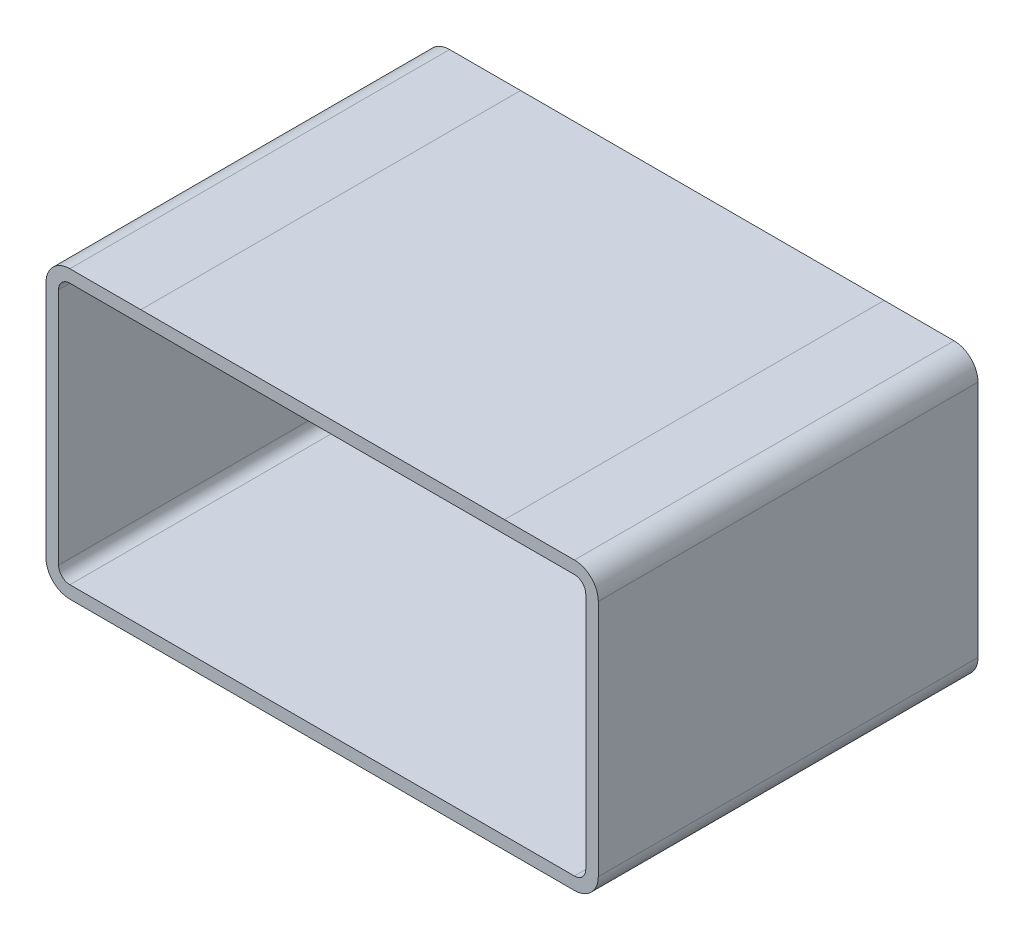
from build123d import *

# Parameters (mm, degrees)
SKETCH1_R           = 2.449
BOSS_EXTRUDE1_DEPTH = 2
BOSS_EXTRUDE2_START = 61.5600102
BOSS_EXTRUDE2_DEPTH = 61.5600102


with BuildPart() as part:
    # Sketch1 → Boss-Extrude1 (new body)
    with BuildSketch(Plane(origin=(0, 7e-09, 33.21323041), x_dir=(-1, 0, 0), z_dir=(0, -2.14626958308228e-10, -1.0))):
        with BuildLine():
            Line((-81.739723186, 76.765508674), (-70.033136805, 76.765508674))
            Line((-70.033136805, 76.765508674), (-9.168561928, 76.76533218))
            Line((-9.168561928, 76.76533218), (2.715276814, 76.76533218))
            ThreePointArc((2.715276814, 76.76533218), (5.543703939, 75.593759305), (6.715276814, 72.76533218))
            Line((6.715276814, 72.76533218), (6.715276814, 40.456513609))
            Line((6.715276814, 40.456513609), (6.715276814, 38.856513609))
            Line((6.715276814, 38.856513609), (6.715276814, 32.856513609))
            ThreePointArc((6.715276814, 32.856513609), (5.543703939, 30.028086484), (2.715276814, 28.856513609))
            Line((2.715276814, 28.856513609), (-81.739723186, 28.856513609))
            ThreePointArc((-81.739723186, 28.856513609), (-84.56815031, 30.028086484), (-85.739723186, 32.856513609))
            Line((-85.739723186, 32.856513609), (-85.739723186, 38.856513609))
            Line((-85.739723186, 38.856513609), (-85.739723186, 40.456513609))
            Line((-85.739723186, 40.456513609), (-85.739723186, 72.765508674))
            ThreePointArc((-85.739723186, 72.765508674), (-84.56815031, 75.593935798), (-81.739723186, 76.765508674))
        make_face()
        with Locations(Location((-2.764563873, 57.52531361, 0), (0, 0, 90))):
            Circle(SKETCH1_R, mode=Mode.SUBTRACT)
        with Locations(Location((-76.437246444, 57.525527244, 0), (0, 0, 90))):
            Circle(SKETCH1_R, mode=Mode.SUBTRACT)
        with BuildLine():
            Line((-63.603943309, 45.46049003), (-60.552841344, 45.460481183))
            Line((-60.552841344, 45.460481183), (-18.649041914, 45.460359671))
            Line((-18.649041914, 45.460359671), (-15.597940144, 45.460350824))
            ThreePointArc((-15.597940144, 45.460350824), (-12.365044057, 46.799449246), (-11.025926886, 50.032337566))
            Line((-11.025926886, 50.032337566), (-11.02588343, 65.018337566))
            ThreePointArc((-11.02588343, 65.018337566), (-12.364981852, 68.251233653), (-15.597870172, 69.590350824))
            Line((-15.597870172, 69.590350824), (-18.648972138, 69.59035918))
            Line((-18.648972138, 69.59035918), (-37.600871755, 69.590414358))
            Line((-37.600871755, 69.590414358), (-37.600871755, 70.340426004))
            Line((-37.600871755, 70.340426004), (-41.600871755, 70.340426004))
            Line((-41.600871755, 70.340426004), (-41.600871755, 69.590426004))
            Line((-41.600871755, 69.590426004), (-60.552771373, 69.590481183))
            Line((-60.552771373, 69.590481183), (-63.603873338, 69.59049003))
            ThreePointArc((-63.603873338, 69.59049003), (-66.836769424, 68.251391608), (-68.175886596, 65.018503288))
            Line((-68.175886596, 65.018503288), (-68.175930051, 50.032503288))
            ThreePointArc((-68.175930051, 50.032503288), (-66.83683163, 46.799607201), (-63.603943309, 45.46049003))
        make_face(mode=Mode.SUBTRACT)
    extrude(amount=BOSS_EXTRUDE1_DEPTH)

    # Sketch2 → Boss-Extrude2 (add)
    with BuildSketch(Plane.XY.offset(33.21323041).offset(BOSS_EXTRUDE2_START)):
        with BuildLine():
            Line((81.739723186, 28.856513609), (-2.715276814, 28.856513609))
            ThreePointArc((-2.715276814, 28.856513609), (-5.543703939, 30.028086484), (-6.715276814, 32.856513609))
            Line((-6.715276814, 32.856513609), (-6.715276814, 72.76533218))
            ThreePointArc((-6.715276814, 72.76533218), (-5.543703939, 75.593759305), (-2.715276814, 76.76533218))
            Line((-2.715276814, 76.76533218), (9.168561928, 76.76533218))
            Line((9.168561928, 76.76533218), (70.033136805, 76.765508674))
            Line((70.033136805, 76.765508674), (81.739723186, 76.765508674))
            ThreePointArc((81.739723186, 76.765508674), (84.56815031, 75.593935798), (85.739723186, 72.765508674))
            Line((85.739723186, 72.765508674), (85.739723186, 32.856513609))
            ThreePointArc((85.739723186, 32.856513609), (84.56815031, 30.028086484), (81.739723186, 28.856513609))
        make_face()
        with BuildLine():
            Line((9.168568018, 74.66533218), (70.033142895, 74.665508674))
            Line((70.033142895, 74.665508674), (81.739723186, 74.665508674))
            ThreePointArc((81.739723186, 74.665508674), (83.08322607, 74.109011558), (83.639723186, 72.765508674))
            Line((83.639723186, 72.765508674), (83.639723186, 32.856513609))
            ThreePointArc((83.639723186, 32.856513609), (83.08322607, 31.513010725), (81.739723186, 30.956513609))
            Line((81.739723186, 30.956513609), (-2.715276814, 30.956513609))
            ThreePointArc((-2.715276814, 30.956513609), (-4.058779699, 31.513010725), (-4.615276814, 32.856513609))
            Line((-4.615276814, 32.856513609), (-4.615276814, 72.76533218))
            ThreePointArc((-4.615276814, 72.76533218), (-4.058779699, 74.108835065), (-2.715276814, 74.66533218))
            Line((-2.715276814, 74.66533218), (9.168568018, 74.66533218))
        make_face(mode=Mode.SUBTRACT)
    extrude(amount=-BOSS_EXTRUDE2_DEPTH)


solid = part.part
